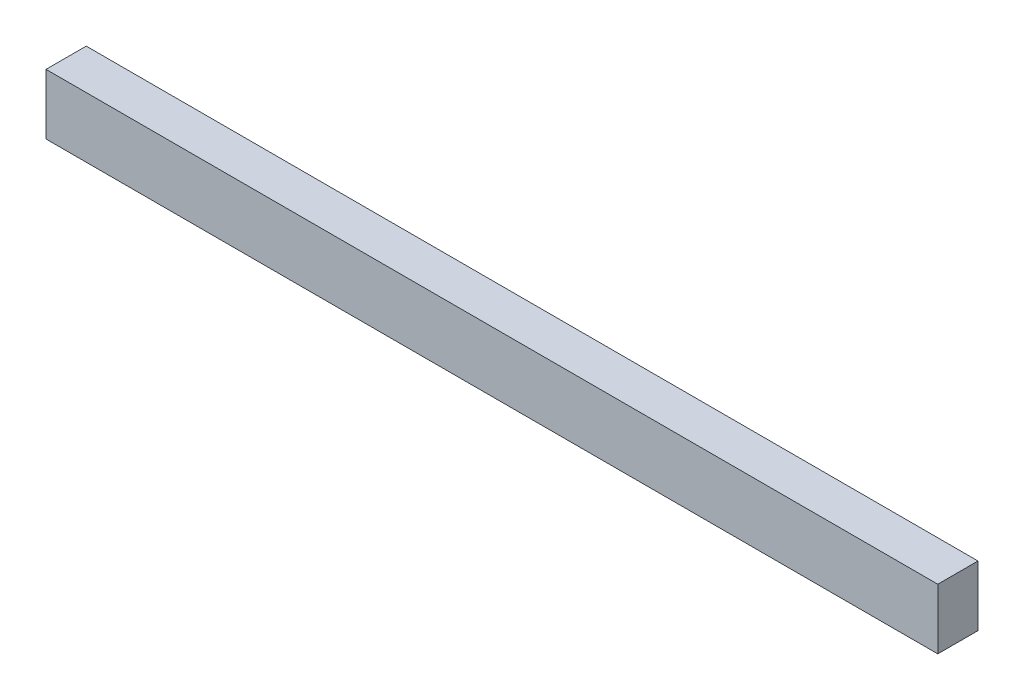
from build123d import *

# Parameters (mm, degrees)
SKETCH1_W           = 399
SKETCH1_H           = 18
BOSS_EXTRUDE1_DEPTH = 27


with BuildPart() as part:
    # Sketch1 → Boss-Extrude1 (new body)
    with BuildSketch(Plane(origin=(0, 0, 0), x_dir=(1, 0, 0), z_dir=(0, 1, 0))):
        with Locations((31.180590934, 58.976137625)):
            Rectangle(SKETCH1_W, SKETCH1_H)
    extrude(amount=BOSS_EXTRUDE1_DEPTH)


solid = part.part
